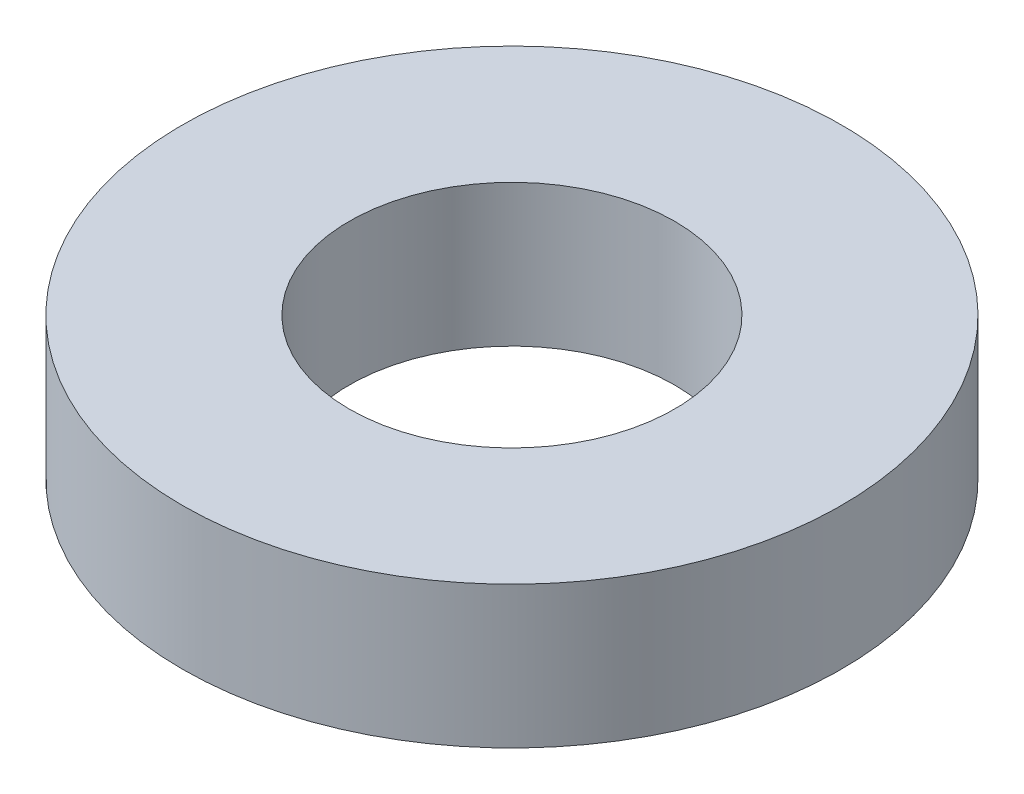
from build123d import *

# Parameters (mm, degrees)
SKETCH_1_R      = 39.5
SKETCH_1_R_2    = 19.5
EXTRUDE_1_DEPTH = 17


with BuildPart() as part:
    # 草图1 → 凸台-拉伸1 (new body)
    with BuildSketch(Plane(origin=(0, 0, 0), x_dir=(1, 0, 0), z_dir=(0, 1, 0))):
        with Locations(Location((0, 0, 0), (0, 0, 270))):
            Circle(SKETCH_1_R)
        with Locations(Location((0, 0, 0), (0, 0, 270))):
            Circle(SKETCH_1_R_2, mode=Mode.SUBTRACT)
    extrude(amount=EXTRUDE_1_DEPTH)


solid = part.part
